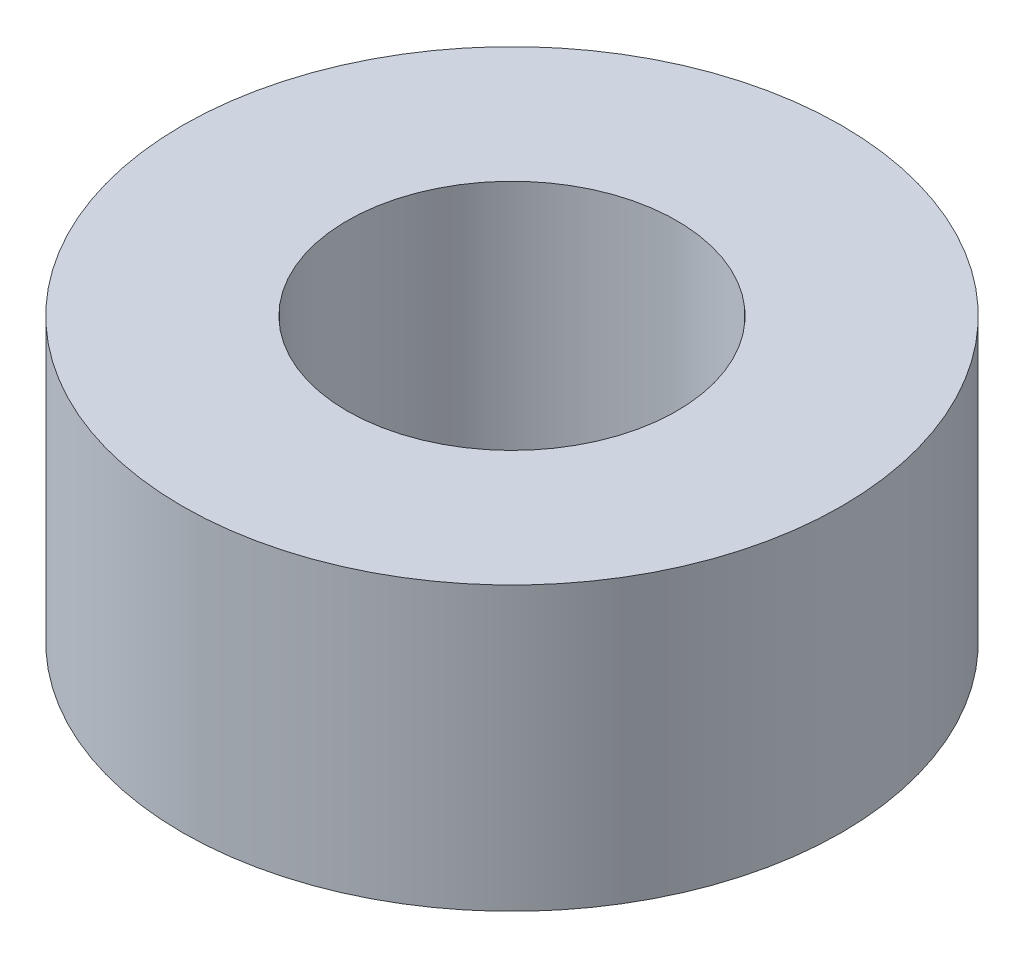
from build123d import *

# Parameters (mm, degrees)
SKETCH_1_R      = 3.5
SKETCH_1_R_2    = 1.75
EXTRUDE_1_DEPTH = 3


with BuildPart() as part:
    # 草图1 → 凸台-拉伸1 (new body)
    with BuildSketch(Plane(origin=(0, 0, 0), x_dir=(1, 0, 0), z_dir=(0, 1, 0))):
        with Locations(Location((0, 0, 0), (0, 0, 270))):
            Circle(SKETCH_1_R)
        with Locations(Location((0, 0, 0), (0, 0, 270))):
            Circle(SKETCH_1_R_2, mode=Mode.SUBTRACT)
    extrude(amount=EXTRUDE_1_DEPTH)


solid = part.part
